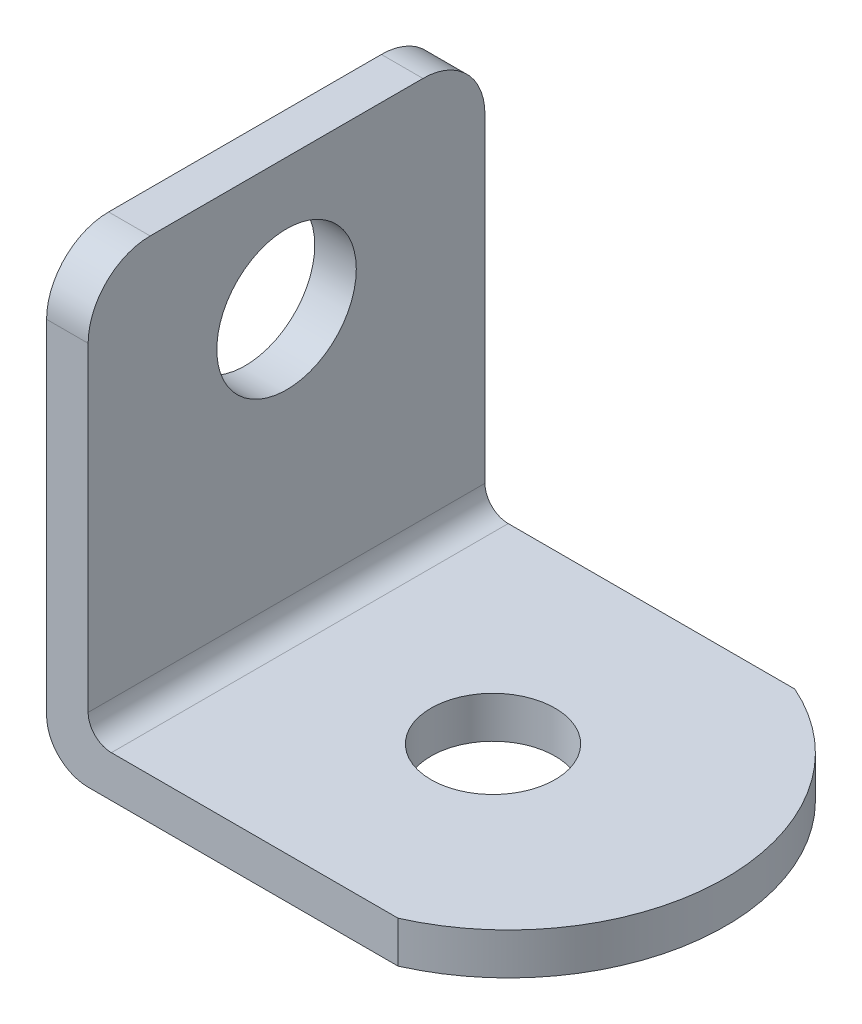
from build123d import *

# Parameters (mm, degrees)
SKETCH1_W           = 12.8
SKETCH1_H           = 14.4
SKETCH1_R           = 2.25
BOSS_EXTRUDE1_DEPTH = 1.34
SKETCH2_R           = 2
BOSS_EXTRUDE2_DEPTH = 1.34
FILLET2_R           = 2
FILLET3_R           = 0.75
FILLET4_R           = 1.34


with BuildPart() as part:
    # Sketch1 → Boss-Extrude1 (new body)
    with BuildSketch(Plane(origin=(0, 0, 0), x_dir=(0, 0, -1), z_dir=(1, 0, 0))):
        with Locations((0, 7.2)):
            Rectangle(SKETCH1_W, SKETCH1_H)
        with Locations((0, 10.15)):
            Circle(SKETCH1_R, mode=Mode.SUBTRACT)
    extrude(amount=BOSS_EXTRUDE1_DEPTH)

    # Sketch2 → Boss-Extrude2 (add)
    with BuildSketch(Plane(origin=(0, 0, 0), x_dir=(1, 0, 0), z_dir=(0, 1, 0))):
        with BuildLine():
            Line((0, 6.4), (11.335489376, 6.4))
            ThreePointArc((11.335489376, 6.4), (15.5, 0), (11.335489376, -6.4))
            Line((11.335489376, -6.4), (0, -6.4))
            Line((0, -6.4), (0, 6.4))
        make_face()
        with Locations(Location((8, 0, 0), (0, 0, 270))):
            Circle(SKETCH2_R, mode=Mode.SUBTRACT)
    extrude(amount=BOSS_EXTRUDE2_DEPTH)

    # Fillet2
    fillet2_edges = [part.edges().sort_by_distance(p)[0] for p in [
        (0.67, 14.4, -6.4),
        (0.67, 14.4, 6.4),
    ]]
    fillet(fillet2_edges, radius=FILLET2_R)

    # Fillet3
    fillet3_edges = [part.edges().sort_by_distance(p)[0] for p in [
        (1.34, 1.34, 0),
    ]]
    fillet(fillet3_edges, radius=FILLET3_R)

    # Fillet4
    fillet4_edges = [part.edges().sort_by_distance(p)[0] for p in [
        (0, 0, 0),
    ]]
    fillet(fillet4_edges, radius=FILLET4_R)


solid = part.part
